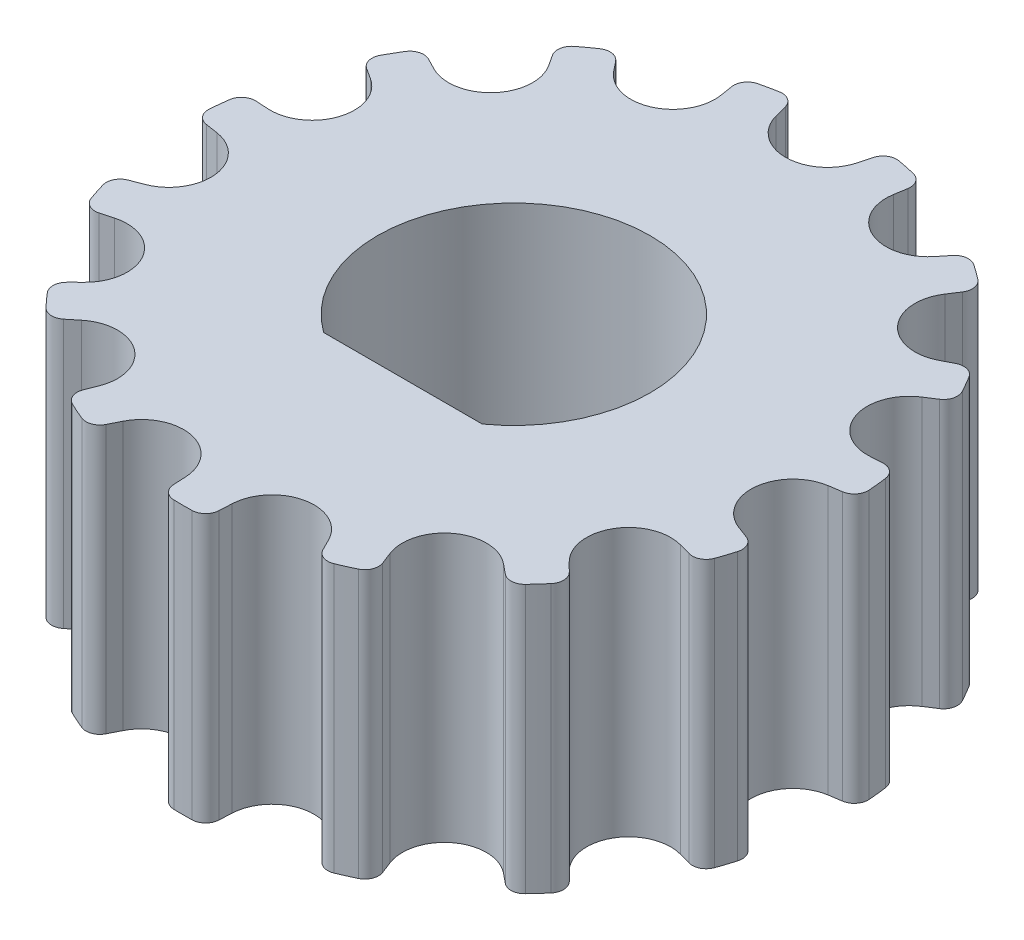
from build123d import *

# Parameters (mm, degrees)
SKETCH1_R           = 7.161972439
BOSS_EXTRUDE1_DEPTH = 5.8
CUT_EXTRUDE1_DEPTH  = 12.671662197
CIRPATTERN1_COUNT   = 15
CUT_EXTRUDE2_DEPTH  = 12.659198501


with BuildPart() as part:
    # Sketch1 → Boss-Extrude1 (new body)
    with BuildSketch(Plane(origin=(0, 0, 0), x_dir=(1, 0, 0), z_dir=(0, 1, 0))):
        with Locations(Location((0, 0, 0), (0, 0, 270))):
            Circle(SKETCH1_R)
    extrude(amount=BOSS_EXTRUDE1_DEPTH)

    # Sketch2 → Cut-Extrude1 (cut, through all)
    with BuildSketch(Plane(origin=(0, 5.8, 0), x_dir=(1, 0, 0), z_dir=(0, 1, 0))):
        with BuildLine():
            Line((-0.879885324, 6.559804793), (-0.95, 6.825530337))
            ThreePointArc((-0.95, 6.825530337), (-1.079308013, 7.002279754), (-1.294287054, 7.044052118))
            ThreePointArc((-1.294287054, 7.044052118), (-2.118539526, 6.841464719), (-2.913036628, 6.54278739))
            Line((-2.913036628, 6.54278739), (-2.913036628, 7.161972439))
            Line((-2.913036628, 7.161972439), (2.913036628, 7.161972439))
            Line((2.913036628, 7.161972439), (2.913036628, 6.54278739))
            ThreePointArc((2.913036628, 6.54278739), (2.118539526, 6.841464719), (1.294287054, 7.044052118))
            ThreePointArc((1.294287054, 7.044052118), (1.079308013, 7.002279754), (0.95, 6.825530337))
            Line((0.95, 6.825530337), (0.879885324, 6.559804793))
            ThreePointArc((0.879885324, 6.559804793), (0, 5.881972439), (-0.879885324, 6.559804793))
        make_face()
    cut_extrude1 = extrude(amount=-CUT_EXTRUDE1_DEPTH, mode=Mode.SUBTRACT)

    # CirPattern1: Cut-Extrude1 ×15 about axis
    cirpattern1_axis = Axis((0, 0, 0), (0, 1, 0))
    for i in range(1, CIRPATTERN1_COUNT):
        add(cut_extrude1.rotate(cirpattern1_axis, i * 360 / CIRPATTERN1_COUNT), mode=Mode.SUBTRACT)

    # Sketch3 → Cut-Extrude2 (cut, through all)
    with BuildSketch(Plane.XZ):
        with BuildLine():
            Line((1.71537168, 2.4), (-1.71537168, 2.4))
            ThreePointArc((-1.71537168, 2.4), (0, -2.95), (1.71537168, 2.4))
        make_face()
    extrude(amount=-CUT_EXTRUDE2_DEPTH, mode=Mode.SUBTRACT)


solid = part.part
